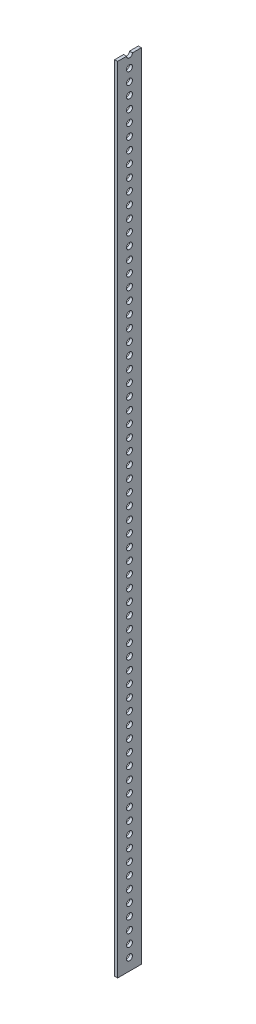
from build123d import *

# Parameters (mm, degrees)
SKETCH1_W           = 25.4
SKETCH1_H           = 1397
SKETCH1_R           = 3.175
BOSS_EXTRUDE1_DEPTH = 3.175
SKETCH2_W           = 25.4
SKETCH2_H           = 546.210923287
CUT_EXTRUDE1_DEPTH  = 699.622659685


with BuildPart() as part:
    # Sketch1 → Boss-Extrude1 (new body)
    with BuildSketch(Plane(origin=(0, 0, 0), x_dir=(0, 0, -1), z_dir=(1, 0, 0))):
        Rectangle(SKETCH1_W, SKETCH1_H)
        with Locations((0, -685.8)):
            Circle(SKETCH1_R, mode=Mode.SUBTRACT)
        with Locations((0, -673.1)):
            Circle(SKETCH1_R, mode=Mode.SUBTRACT)
        with Locations((0, -660.4)):
            Circle(SKETCH1_R, mode=Mode.SUBTRACT)
        with Locations((0, -647.7)):
            Circle(SKETCH1_R, mode=Mode.SUBTRACT)
        with Locations((0, -635)):
            Circle(SKETCH1_R, mode=Mode.SUBTRACT)
        with Locations((0, -622.3)):
            Circle(SKETCH1_R, mode=Mode.SUBTRACT)
        with Locations((0, -609.6)):
            Circle(SKETCH1_R, mode=Mode.SUBTRACT)
        with Locations((0, -596.9)):
            Circle(SKETCH1_R, mode=Mode.SUBTRACT)
        with Locations((0, -584.2)):
            Circle(SKETCH1_R, mode=Mode.SUBTRACT)
        with Locations((0, -571.5)):
            Circle(SKETCH1_R, mode=Mode.SUBTRACT)
        with Locations((0, -558.8)):
            Circle(SKETCH1_R, mode=Mode.SUBTRACT)
        with Locations((0, -546.1)):
            Circle(SKETCH1_R, mode=Mode.SUBTRACT)
        with Locations((0, -533.4)):
            Circle(SKETCH1_R, mode=Mode.SUBTRACT)
        with Locations((0, -520.7)):
            Circle(SKETCH1_R, mode=Mode.SUBTRACT)
        with Locations((0, -508)):
            Circle(SKETCH1_R, mode=Mode.SUBTRACT)
        with Locations((0, -495.3)):
            Circle(SKETCH1_R, mode=Mode.SUBTRACT)
        with Locations((0, -482.6)):
            Circle(SKETCH1_R, mode=Mode.SUBTRACT)
        with Locations((0, -469.9)):
            Circle(SKETCH1_R, mode=Mode.SUBTRACT)
        with Locations((0, -457.2)):
            Circle(SKETCH1_R, mode=Mode.SUBTRACT)
        with Locations((0, -444.5)):
            Circle(SKETCH1_R, mode=Mode.SUBTRACT)
        with Locations((0, -431.8)):
            Circle(SKETCH1_R, mode=Mode.SUBTRACT)
        with Locations((0, -419.1)):
            Circle(SKETCH1_R, mode=Mode.SUBTRACT)
        with Locations((0, -406.4)):
            Circle(SKETCH1_R, mode=Mode.SUBTRACT)
        with Locations((0, -393.7)):
            Circle(SKETCH1_R, mode=Mode.SUBTRACT)
        with Locations((0, -381)):
            Circle(SKETCH1_R, mode=Mode.SUBTRACT)
        with Locations((0, -368.3)):
            Circle(SKETCH1_R, mode=Mode.SUBTRACT)
        with Locations((0, -355.6)):
            Circle(SKETCH1_R, mode=Mode.SUBTRACT)
        with Locations((0, -342.9)):
            Circle(SKETCH1_R, mode=Mode.SUBTRACT)
        with Locations((0, -330.2)):
            Circle(SKETCH1_R, mode=Mode.SUBTRACT)
        with Locations((0, -317.5)):
            Circle(SKETCH1_R, mode=Mode.SUBTRACT)
        with Locations((0, -304.8)):
            Circle(SKETCH1_R, mode=Mode.SUBTRACT)
        with Locations((0, -292.1)):
            Circle(SKETCH1_R, mode=Mode.SUBTRACT)
        with Locations((0, -279.4)):
            Circle(SKETCH1_R, mode=Mode.SUBTRACT)
        with Locations((0, -266.7)):
            Circle(SKETCH1_R, mode=Mode.SUBTRACT)
        with Locations((0, -254)):
            Circle(SKETCH1_R, mode=Mode.SUBTRACT)
        with Locations((0, -241.3)):
            Circle(SKETCH1_R, mode=Mode.SUBTRACT)
        with Locations((0, -228.6)):
            Circle(SKETCH1_R, mode=Mode.SUBTRACT)
        with Locations((0, -215.9)):
            Circle(SKETCH1_R, mode=Mode.SUBTRACT)
        with Locations((0, -203.2)):
            Circle(SKETCH1_R, mode=Mode.SUBTRACT)
        with Locations((0, -190.5)):
            Circle(SKETCH1_R, mode=Mode.SUBTRACT)
        with Locations((0, -177.8)):
            Circle(SKETCH1_R, mode=Mode.SUBTRACT)
        with Locations((0, -165.1)):
            Circle(SKETCH1_R, mode=Mode.SUBTRACT)
        with Locations((0, -152.4)):
            Circle(SKETCH1_R, mode=Mode.SUBTRACT)
        with Locations((0, -139.7)):
            Circle(SKETCH1_R, mode=Mode.SUBTRACT)
        with Locations((0, -127)):
            Circle(SKETCH1_R, mode=Mode.SUBTRACT)
        with Locations((0, -114.3)):
            Circle(SKETCH1_R, mode=Mode.SUBTRACT)
        with Locations((0, -101.6)):
            Circle(SKETCH1_R, mode=Mode.SUBTRACT)
        with Locations((0, -88.9)):
            Circle(SKETCH1_R, mode=Mode.SUBTRACT)
        with Locations((0, -76.2)):
            Circle(SKETCH1_R, mode=Mode.SUBTRACT)
        with Locations((0, -63.5)):
            Circle(SKETCH1_R, mode=Mode.SUBTRACT)
        with Locations((0, -50.8)):
            Circle(SKETCH1_R, mode=Mode.SUBTRACT)
        with Locations((0, -38.1)):
            Circle(SKETCH1_R, mode=Mode.SUBTRACT)
        with Locations((0, -25.4)):
            Circle(SKETCH1_R, mode=Mode.SUBTRACT)
        with Locations((0, -12.7)):
            Circle(SKETCH1_R, mode=Mode.SUBTRACT)
        Circle(SKETCH1_R, mode=Mode.SUBTRACT)
        with Locations((0, 12.7)):
            Circle(SKETCH1_R, mode=Mode.SUBTRACT)
        with Locations((0, 25.4)):
            Circle(SKETCH1_R, mode=Mode.SUBTRACT)
        with Locations((0, 38.1)):
            Circle(SKETCH1_R, mode=Mode.SUBTRACT)
        with Locations((0, 50.8)):
            Circle(SKETCH1_R, mode=Mode.SUBTRACT)
        with Locations((0, 63.5)):
            Circle(SKETCH1_R, mode=Mode.SUBTRACT)
        with Locations((0, 76.2)):
            Circle(SKETCH1_R, mode=Mode.SUBTRACT)
        with Locations((0, 88.9)):
            Circle(SKETCH1_R, mode=Mode.SUBTRACT)
        with Locations((0, 101.6)):
            Circle(SKETCH1_R, mode=Mode.SUBTRACT)
        with Locations((0, 114.3)):
            Circle(SKETCH1_R, mode=Mode.SUBTRACT)
        with Locations((0, 127)):
            Circle(SKETCH1_R, mode=Mode.SUBTRACT)
        with Locations((0, 139.7)):
            Circle(SKETCH1_R, mode=Mode.SUBTRACT)
        with Locations((0, 152.4)):
            Circle(SKETCH1_R, mode=Mode.SUBTRACT)
        with Locations((0, 165.1)):
            Circle(SKETCH1_R, mode=Mode.SUBTRACT)
        with Locations((0, 177.8)):
            Circle(SKETCH1_R, mode=Mode.SUBTRACT)
        with Locations((0, 190.5)):
            Circle(SKETCH1_R, mode=Mode.SUBTRACT)
        with Locations((0, 203.2)):
            Circle(SKETCH1_R, mode=Mode.SUBTRACT)
        with Locations((0, 215.9)):
            Circle(SKETCH1_R, mode=Mode.SUBTRACT)
        with Locations((0, 228.6)):
            Circle(SKETCH1_R, mode=Mode.SUBTRACT)
        with Locations((0, 241.3)):
            Circle(SKETCH1_R, mode=Mode.SUBTRACT)
        with Locations((0, 254)):
            Circle(SKETCH1_R, mode=Mode.SUBTRACT)
        with Locations((0, 266.7)):
            Circle(SKETCH1_R, mode=Mode.SUBTRACT)
        with Locations((0, 279.4)):
            Circle(SKETCH1_R, mode=Mode.SUBTRACT)
        with Locations((0, 292.1)):
            Circle(SKETCH1_R, mode=Mode.SUBTRACT)
        with Locations((0, 304.8)):
            Circle(SKETCH1_R, mode=Mode.SUBTRACT)
        with Locations((0, 317.5)):
            Circle(SKETCH1_R, mode=Mode.SUBTRACT)
        with Locations((0, 330.2)):
            Circle(SKETCH1_R, mode=Mode.SUBTRACT)
        with Locations((0, 342.9)):
            Circle(SKETCH1_R, mode=Mode.SUBTRACT)
        with Locations((0, 355.6)):
            Circle(SKETCH1_R, mode=Mode.SUBTRACT)
        with Locations((0, 368.3)):
            Circle(SKETCH1_R, mode=Mode.SUBTRACT)
        with Locations((0, 381)):
            Circle(SKETCH1_R, mode=Mode.SUBTRACT)
        with Locations((0, 393.7)):
            Circle(SKETCH1_R, mode=Mode.SUBTRACT)
        with Locations((0, 406.4)):
            Circle(SKETCH1_R, mode=Mode.SUBTRACT)
        with Locations((0, 419.1)):
            Circle(SKETCH1_R, mode=Mode.SUBTRACT)
        with Locations((0, 431.8)):
            Circle(SKETCH1_R, mode=Mode.SUBTRACT)
        with Locations((0, 444.5)):
            Circle(SKETCH1_R, mode=Mode.SUBTRACT)
        with Locations((0, 457.2)):
            Circle(SKETCH1_R, mode=Mode.SUBTRACT)
        with Locations((0, 469.9)):
            Circle(SKETCH1_R, mode=Mode.SUBTRACT)
        with Locations((0, 482.6)):
            Circle(SKETCH1_R, mode=Mode.SUBTRACT)
        with Locations((0, 495.3)):
            Circle(SKETCH1_R, mode=Mode.SUBTRACT)
        with Locations((0, 508)):
            Circle(SKETCH1_R, mode=Mode.SUBTRACT)
        with Locations((0, 520.7)):
            Circle(SKETCH1_R, mode=Mode.SUBTRACT)
        with Locations((0, 533.4)):
            Circle(SKETCH1_R, mode=Mode.SUBTRACT)
        with Locations((0, 546.1)):
            Circle(SKETCH1_R, mode=Mode.SUBTRACT)
        with Locations((0, 558.8)):
            Circle(SKETCH1_R, mode=Mode.SUBTRACT)
        with Locations((0, 571.5)):
            Circle(SKETCH1_R, mode=Mode.SUBTRACT)
        with Locations((0, 584.2)):
            Circle(SKETCH1_R, mode=Mode.SUBTRACT)
        with Locations((0, 596.9)):
            Circle(SKETCH1_R, mode=Mode.SUBTRACT)
        with Locations((0, 609.6)):
            Circle(SKETCH1_R, mode=Mode.SUBTRACT)
        with Locations((0, 622.3)):
            Circle(SKETCH1_R, mode=Mode.SUBTRACT)
        with Locations((0, 635)):
            Circle(SKETCH1_R, mode=Mode.SUBTRACT)
        with Locations((0, 647.7)):
            Circle(SKETCH1_R, mode=Mode.SUBTRACT)
        with Locations((0, 660.4)):
            Circle(SKETCH1_R, mode=Mode.SUBTRACT)
        with Locations((0, 673.1)):
            Circle(SKETCH1_R, mode=Mode.SUBTRACT)
        with Locations((0, 685.8)):
            Circle(SKETCH1_R, mode=Mode.SUBTRACT)
    extrude(amount=BOSS_EXTRUDE1_DEPTH)

    # Sketch2 → Cut-Extrude1 (cut, through all)
    with BuildSketch(Plane.ZY):
        with Locations((0, 425.394538356)):
            Rectangle(SKETCH2_W, SKETCH2_H)
    extrude(amount=-CUT_EXTRUDE1_DEPTH, mode=Mode.SUBTRACT)


solid = part.part
